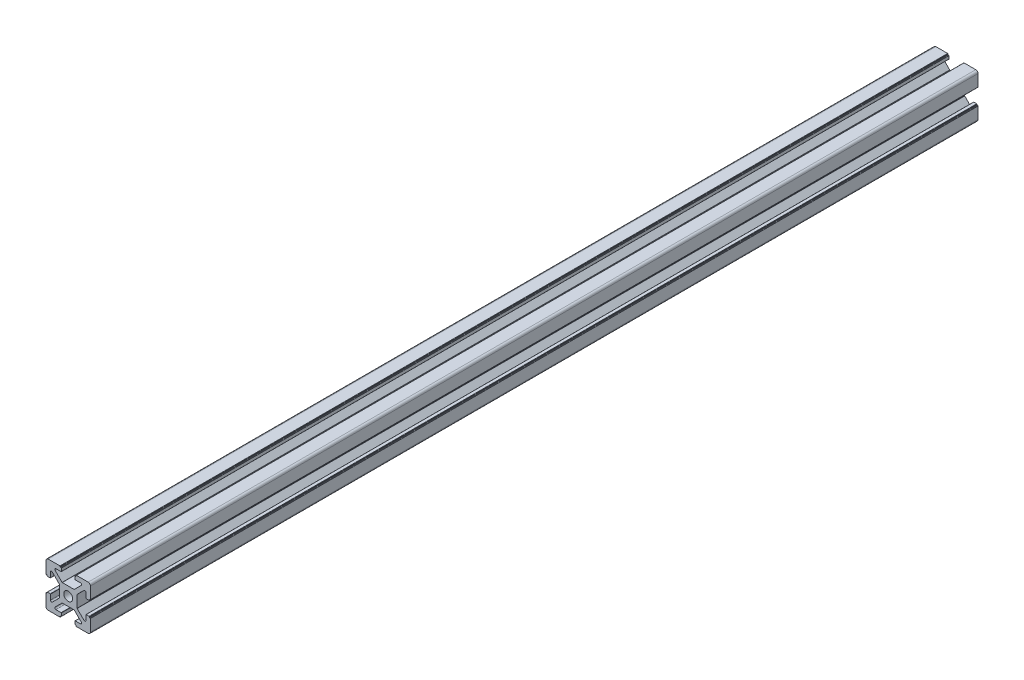
from build123d import *

# Parameters (mm, degrees)
SKETCH1_R           = 2
BOSS_EXTRUDE1_DEPTH = 400


with BuildPart() as part:
    # Sketch1 → Boss-Extrude1 (new body)
    with BuildSketch(Plane.XY):
        with BuildLine():
            Line((-10, 9), (-10, 3.7))
            ThreePointArc((-10, 3.7), (-9.970710678, 3.629289322), (-9.9, 3.6))
            Line((-9.9, 3.6), (-9.6, 3.6))
            ThreePointArc((-9.6, 3.6), (-9.529289322, 3.570710678), (-9.5, 3.5))
            Line((-9.5, 3.5), (-9.5, 3.2))
            ThreePointArc((-9.5, 3.2), (-9.470710678, 3.129289322), (-9.4, 3.1))
            Line((-9.4, 3.1), (-8.1, 3.1))
            ThreePointArc((-8.1, 3.1), (-8.029289322, 3.129289322), (-8, 3.2))
            Line((-8, 3.2), (-8, 5.520101013))
            ThreePointArc((-8, 5.520101013), (-7.691341716, 5.982040779), (-7.146446609, 5.873654403))
            Line((-7.146446609, 5.873654403), (-4.029289322, 2.756497116))
            ThreePointArc((-4.029289322, 2.756497116), (-4.007612047, 2.724054781), (-4, 2.685786438))
            Line((-4, 2.685786438), (-4, 0))
            Line((-4, 0), (-4, -2.685786438))
            ThreePointArc((-4, -2.685786438), (-4.007612047, -2.724054781), (-4.029289322, -2.756497116))
            Line((-4.029289322, -2.756497116), (-7.146446609, -5.873654403))
            ThreePointArc((-7.146446609, -5.873654403), (-7.691341716, -5.982040779), (-8, -5.520101013))
            Line((-8, -5.520101013), (-8, -3.2))
            ThreePointArc((-8, -3.2), (-8.029289322, -3.129289322), (-8.1, -3.1))
            Line((-8.1, -3.1), (-9.4, -3.1))
            ThreePointArc((-9.4, -3.1), (-9.470710678, -3.129289322), (-9.5, -3.2))
            Line((-9.5, -3.2), (-9.5, -3.5))
            ThreePointArc((-9.5, -3.5), (-9.529289322, -3.570710678), (-9.6, -3.6))
            Line((-9.6, -3.6), (-9.9, -3.6))
            ThreePointArc((-9.9, -3.6), (-9.970710678, -3.629289322), (-10, -3.7))
            Line((-10, -3.7), (-10, -9))
            ThreePointArc((-10, -9), (-9.707106781, -9.707106781), (-9, -10))
            Line((-9, -10), (-3.7, -10))
            ThreePointArc((-3.7, -10), (-3.629289322, -9.970710678), (-3.6, -9.9))
            Line((-3.6, -9.9), (-3.6, -9.6))
            ThreePointArc((-3.6, -9.6), (-3.570710678, -9.529289322), (-3.5, -9.5))
            Line((-3.5, -9.5), (-3.2, -9.5))
            ThreePointArc((-3.2, -9.5), (-3.129289322, -9.470710678), (-3.1, -9.4))
            Line((-3.1, -9.4), (-3.1, -8.1))
            ThreePointArc((-3.1, -8.1), (-3.129289322, -8.029289322), (-3.2, -8))
            Line((-3.2, -8), (-5.520101013, -8))
            ThreePointArc((-5.520101013, -8), (-5.982040779, -7.691341716), (-5.873654403, -7.146446609))
            Line((-5.873654403, -7.146446609), (-2.756497116, -4.029289322))
            ThreePointArc((-2.756497116, -4.029289322), (-2.724054781, -4.007612047), (-2.685786438, -4))
            Line((-2.685786438, -4), (2.685786438, -4))
            ThreePointArc((2.685786438, -4), (2.724054781, -4.007612047), (2.756497116, -4.029289322))
            Line((2.756497116, -4.029289322), (5.873654403, -7.146446609))
            ThreePointArc((5.873654403, -7.146446609), (5.982040779, -7.691341716), (5.520101013, -8))
            Line((5.520101013, -8), (3.2, -8))
            ThreePointArc((3.2, -8), (3.129289322, -8.029289322), (3.1, -8.1))
            Line((3.1, -8.1), (3.1, -9.4))
            ThreePointArc((3.1, -9.4), (3.129289322, -9.470710678), (3.2, -9.5))
            Line((3.2, -9.5), (3.5, -9.5))
            ThreePointArc((3.5, -9.5), (3.570710678, -9.529289322), (3.6, -9.6))
            Line((3.6, -9.6), (3.6, -9.9))
            ThreePointArc((3.6, -9.9), (3.629289322, -9.970710678), (3.7, -10))
            Line((3.7, -10), (9, -10))
            ThreePointArc((9, -10), (9.707106781, -9.707106781), (10, -9))
            Line((10, -9), (10, -3.7))
            ThreePointArc((10, -3.7), (9.970710678, -3.629289322), (9.9, -3.6))
            Line((9.9, -3.6), (9.6, -3.6))
            ThreePointArc((9.6, -3.6), (9.529289322, -3.570710678), (9.5, -3.5))
            Line((9.5, -3.5), (9.5, -3.2))
            ThreePointArc((9.5, -3.2), (9.470710678, -3.129289322), (9.4, -3.1))
            Line((9.4, -3.1), (8.1, -3.1))
            ThreePointArc((8.1, -3.1), (8.029289322, -3.129289322), (8, -3.2))
            Line((8, -3.2), (8, -5.520101013))
            ThreePointArc((8, -5.520101013), (7.691341716, -5.982040779), (7.146446609, -5.873654403))
            Line((7.146446609, -5.873654403), (4.029289322, -2.756497116))
            ThreePointArc((4.029289322, -2.756497116), (4.007612047, -2.724054781), (4, -2.685786438))
            Line((4, -2.685786438), (4, 0))
            Line((4, 0), (4, 2.685786438))
            ThreePointArc((4, 2.685786438), (4.007612047, 2.724054781), (4.029289322, 2.756497116))
            Line((4.029289322, 2.756497116), (7.146446609, 5.873654403))
            ThreePointArc((7.146446609, 5.873654403), (7.691341716, 5.982040779), (8, 5.520101013))
            Line((8, 5.520101013), (8, 3.2))
            ThreePointArc((8, 3.2), (8.029289322, 3.129289322), (8.1, 3.1))
            Line((8.1, 3.1), (9.4, 3.1))
            ThreePointArc((9.4, 3.1), (9.470710678, 3.129289322), (9.5, 3.2))
            Line((9.5, 3.2), (9.5, 3.5))
            ThreePointArc((9.5, 3.5), (9.529289322, 3.570710678), (9.6, 3.6))
            Line((9.6, 3.6), (9.9, 3.6))
            ThreePointArc((9.9, 3.6), (9.970710678, 3.629289322), (10, 3.7))
            Line((10, 3.7), (10, 9))
            ThreePointArc((10, 9), (9.707106781, 9.707106781), (9, 10))
            Line((9, 10), (3.7, 10))
            ThreePointArc((3.7, 10), (3.629289322, 9.970710678), (3.6, 9.9))
            Line((3.6, 9.9), (3.6, 9.6))
            ThreePointArc((3.6, 9.6), (3.570710678, 9.529289322), (3.5, 9.5))
            Line((3.5, 9.5), (3.2, 9.5))
            ThreePointArc((3.2, 9.5), (3.129289322, 9.470710678), (3.1, 9.4))
            Line((3.1, 9.4), (3.1, 8.1))
            ThreePointArc((3.1, 8.1), (3.129289322, 8.029289322), (3.2, 8))
            Line((3.2, 8), (5.520101013, 8))
            ThreePointArc((5.520101013, 8), (5.982040779, 7.691341716), (5.873654403, 7.146446609))
            Line((5.873654403, 7.146446609), (2.756497116, 4.029289322))
            ThreePointArc((2.756497116, 4.029289322), (2.724054781, 4.007612047), (2.685786438, 4))
            Line((2.685786438, 4), (-2.685786438, 4))
            ThreePointArc((-2.685786438, 4), (-2.724054781, 4.007612047), (-2.756497116, 4.029289322))
            Line((-2.756497116, 4.029289322), (-5.873654403, 7.146446609))
            ThreePointArc((-5.873654403, 7.146446609), (-5.982040779, 7.691341716), (-5.520101013, 8))
            Line((-5.520101013, 8), (-3.2, 8))
            ThreePointArc((-3.2, 8), (-3.129289322, 8.029289322), (-3.1, 8.1))
            Line((-3.1, 8.1), (-3.1, 9.4))
            ThreePointArc((-3.1, 9.4), (-3.129289322, 9.470710678), (-3.2, 9.5))
            Line((-3.2, 9.5), (-3.5, 9.5))
            ThreePointArc((-3.5, 9.5), (-3.570710678, 9.529289322), (-3.6, 9.6))
            Line((-3.6, 9.6), (-3.6, 9.9))
            ThreePointArc((-3.6, 9.9), (-3.629289322, 9.970710678), (-3.7, 10))
            Line((-3.7, 10), (-9, 10))
            ThreePointArc((-9, 10), (-9.707106781, 9.707106781), (-10, 9))
        make_face()
        Circle(SKETCH1_R, mode=Mode.SUBTRACT)
    extrude(amount=BOSS_EXTRUDE1_DEPTH)


solid = part.part
